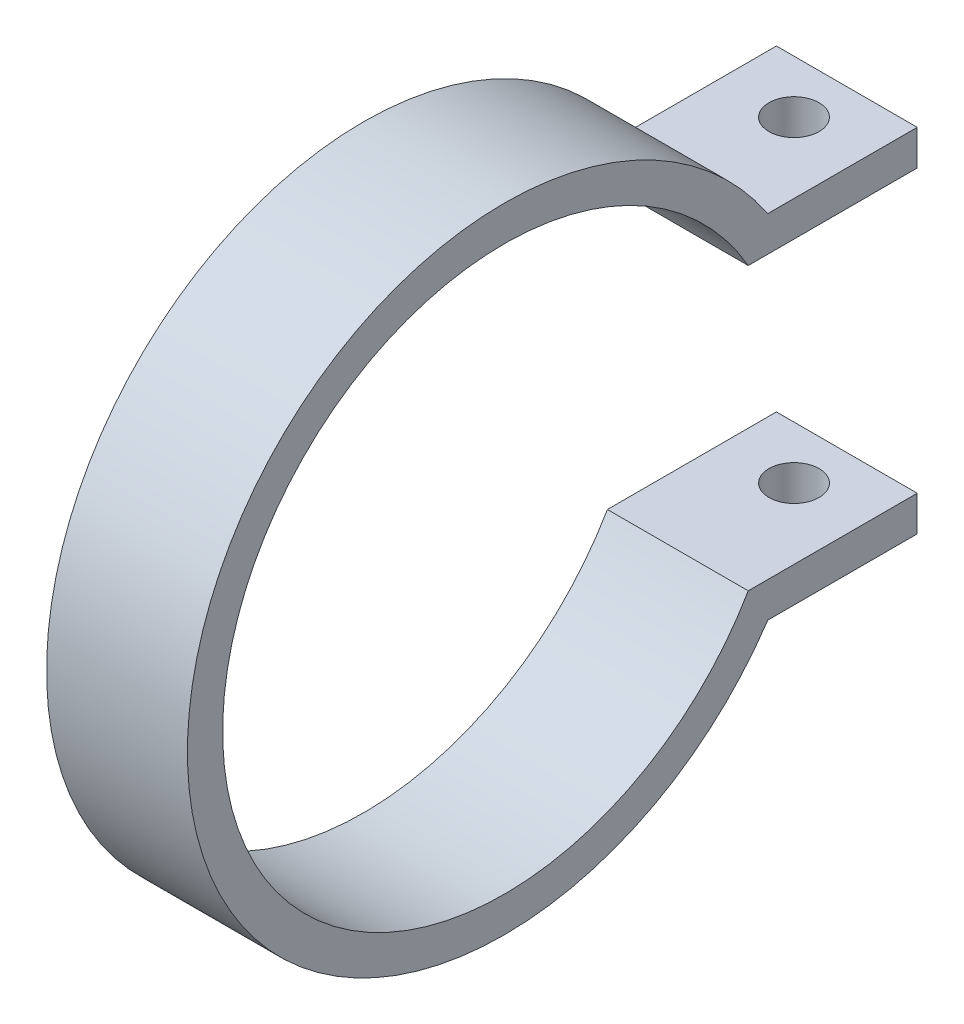
from build123d import *

# Parameters (mm, degrees)
BOSS_EXTRUDE1_DEPTH       = 6.35
TAP_DRILL_FOR_4_40_TAP1_D = 2.2606


with BuildPart() as part:
    # Sketch2 → Boss-Extrude1 (new body)
    with BuildSketch(Plane.YZ):
        with BuildLine():
            Line((-6.35, -10.998522628), (-6.35, -18.618522628))
            Line((-6.35, -18.618522628), (-7.9375, -18.618522628))
            Line((-7.9375, -18.618522628), (-7.9375, -11.879762203))
            ThreePointArc((-7.9375, -11.879762203), (0, 14.2875), (7.9375, -11.879762203))
            Line((7.9375, -11.879762203), (7.9375, -18.618522628))
            Line((7.9375, -18.618522628), (6.35, -18.618522628))
            Line((6.35, -18.618522628), (6.35, -10.998522628))
            ThreePointArc((6.35, -10.998522628), (0, 12.7), (-6.35, -10.998522628))
        make_face()
    extrude(amount=BOSS_EXTRUDE1_DEPTH)

    # Tap Drill for #4-40 Tap1 (through all)
    with Locations(Plane.XZ.offset(7.9375)):
        with Locations((3.175, -16.237272628)):
            Hole(TAP_DRILL_FOR_4_40_TAP1_D / 2)


solid = part.part
